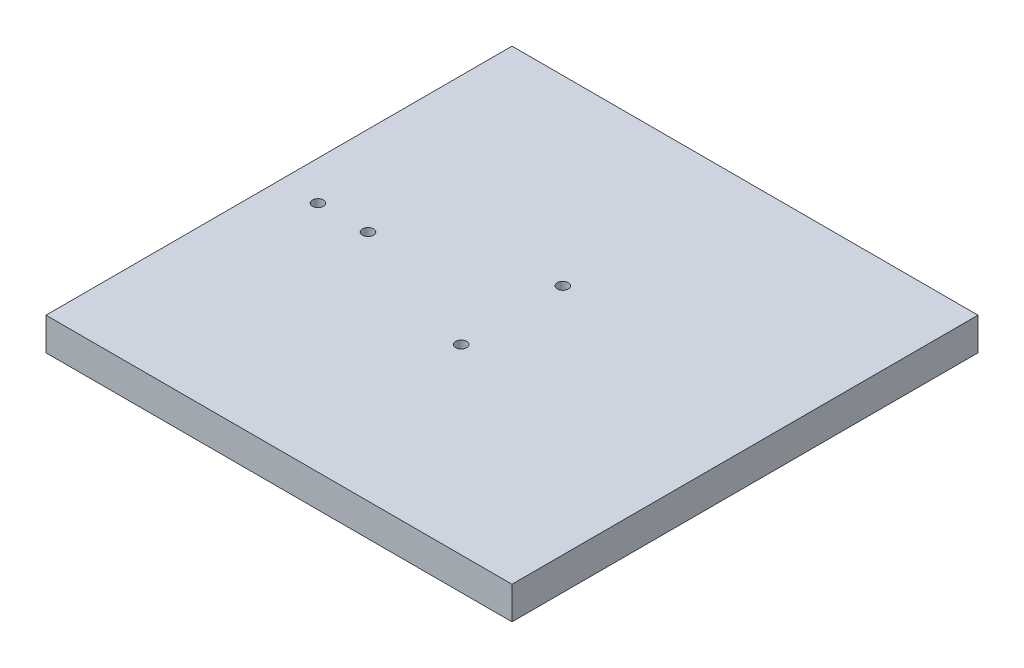
from build123d import *

# Parameters (mm, degrees)
SKETCH1_W           = 139.7
SKETCH1_H           = 9.779
BOSS_EXTRUDE1_DEPTH = 139.7
SKETCH2_R           = 1.65
CUT_EXTRUDE1_DEPTH  = 198.807504511
CUT_EXTRUDE2_DEPTH  = 198.807504511


with BuildPart() as part:
    # Sketch1 → Boss-Extrude1 (new body)
    with BuildSketch(Plane.XY):
        with Locations((69.85, 4.8895)):
            Rectangle(SKETCH1_W, SKETCH1_H)
    extrude(amount=BOSS_EXTRUDE1_DEPTH)

    # Sketch2 → Cut-Extrude1 (cut, through all)
    with BuildSketch(Plane(origin=(0, 9.779, 0), x_dir=(1, 0, 0), z_dir=(0, 1, 0))):
        with Locations(Location((11.684, -69.85, 0), (0, 0, 270))):
            Circle(SKETCH2_R)
        with Locations(Location((26.684, -69.85, 0), (0, 0, 270))):
            Circle(SKETCH2_R)
    extrude(amount=-CUT_EXTRUDE1_DEPTH, mode=Mode.SUBTRACT)

    # Sketch3 → Cut-Extrude2 (cut, through all)
    with BuildSketch(Plane(origin=(0, 9.779, 0), x_dir=(1, 0, 0), z_dir=(0, 1, 0))):
        with BuildLine():
            ThreePointArc((71.5, -54.61), (71.016726189, -53.443273811), (69.85, -52.96))
            Line((69.85, -52.96), (69.85, -54.61))
            Line((69.85, -54.61), (69.85, -56.26))
            ThreePointArc((69.85, -56.26), (71.016726189, -55.776726189), (71.5, -54.61))
        make_face()
        with BuildLine():
            Line((69.85, -54.61), (69.85, -52.96))
            ThreePointArc((69.85, -52.96), (68.2, -54.61), (69.85, -56.26))
            Line((69.85, -56.26), (69.85, -54.61))
        make_face()
        with BuildLine():
            ThreePointArc((71.5, -85.09), (71.016726189, -83.923273811), (69.85, -83.44))
            Line((69.85, -83.44), (69.85, -85.09))
            Line((69.85, -85.09), (69.85, -86.74))
            ThreePointArc((69.85, -86.74), (71.016726189, -86.256726189), (71.5, -85.09))
        make_face()
        with BuildLine():
            Line((69.85, -85.09), (69.85, -83.44))
            ThreePointArc((69.85, -83.44), (68.2, -85.09), (69.85, -86.74))
            Line((69.85, -86.74), (69.85, -85.09))
        make_face()
    extrude(amount=-CUT_EXTRUDE2_DEPTH, mode=Mode.SUBTRACT)


solid = part.part
